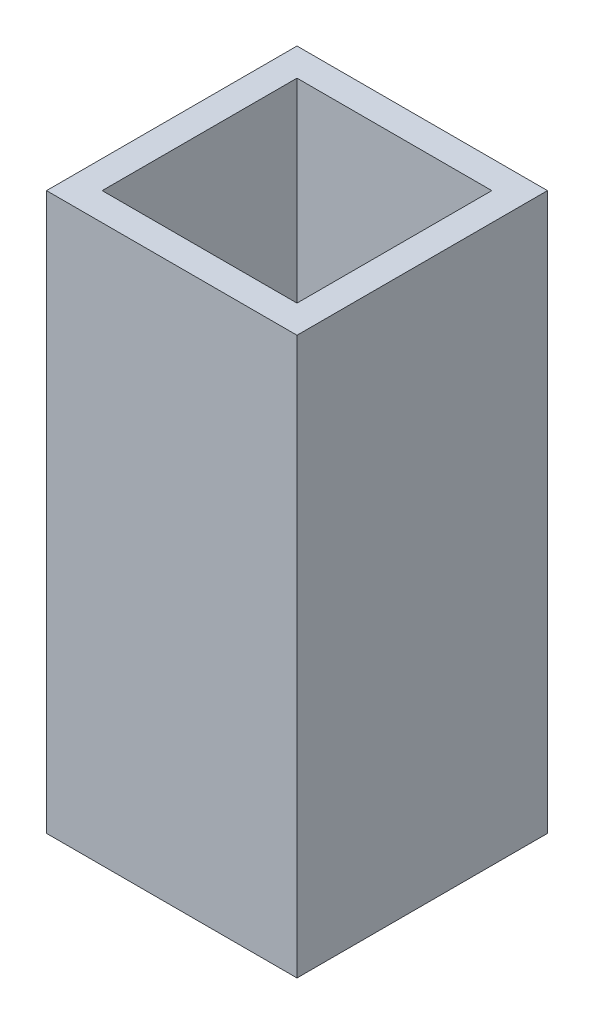
from build123d import *

# Parameters (mm, degrees)
SKETCH_1_W      = 4.5
SKETCH_1_H      = 4.5
SKETCH_1_W_2    = 3.5
SKETCH_1_H_2    = 3.5
EXTRUDE_1_DEPTH = 10


with BuildPart() as part:
    # 草图1 → 凸台-拉伸1 (new body)
    with BuildSketch(Plane(origin=(0, 0, 0), x_dir=(1, 0, 0), z_dir=(0, 1, 0))):
        Rectangle(SKETCH_1_W, SKETCH_1_H)
        Rectangle(SKETCH_1_W_2, SKETCH_1_H_2, mode=Mode.SUBTRACT)
    extrude(amount=EXTRUDE_1_DEPTH)


solid = part.part
